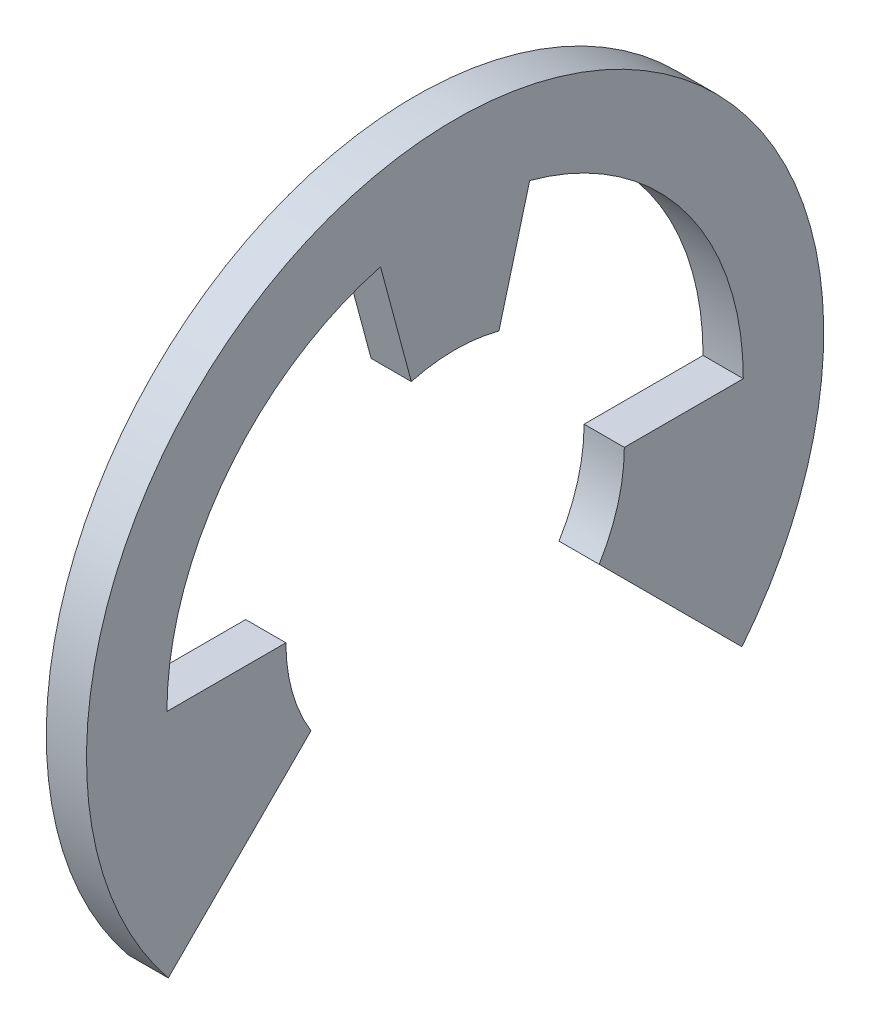
from build123d import *

# Parameters (mm, degrees)
BOSS_EXTRUDE1_DEPTH = 0.6


with BuildPart() as part:
    # Sketch1 → Boss-Extrude1 (new body)
    with BuildSketch(Plane(origin=(0, 0, 0), x_dir=(0, 0, -1), z_dir=(1, 0, 0))):
        with BuildLine():
            Line((-2.525, 0), (-4.3, 0))
            ThreePointArc((-4.3, 0), (-3.411419363, 2.617674145), (-1.112921894, 4.153481053))
            Line((-1.112921894, 4.153481053), (-0.653518089, 2.438962711))
            ThreePointArc((-0.653518089, 2.438962711), (0, 2.525), (0.653518089, 2.438962711))
            Line((0.653518089, 2.438962711), (1.112921894, 4.153481053))
            ThreePointArc((1.112921894, 4.153481053), (3.411419363, 2.617674145), (4.3, 0))
            Line((4.3, 0), (2.525, 0))
            ThreePointArc((2.525, 0), (2.429441808, -0.688067947), (2.15, -1.324056268))
            Line((2.15, -1.324056268), (4.28007081, -3.454127077))
            ThreePointArc((4.28007081, -3.454127077), (0, 5.5), (-4.28007081, -3.454127077))
            Line((-4.28007081, -3.454127077), (-2.15, -1.324056268))
            ThreePointArc((-2.15, -1.324056268), (-2.429441808, -0.688067947), (-2.525, 0))
        make_face()
    extrude(amount=BOSS_EXTRUDE1_DEPTH)


solid = part.part
